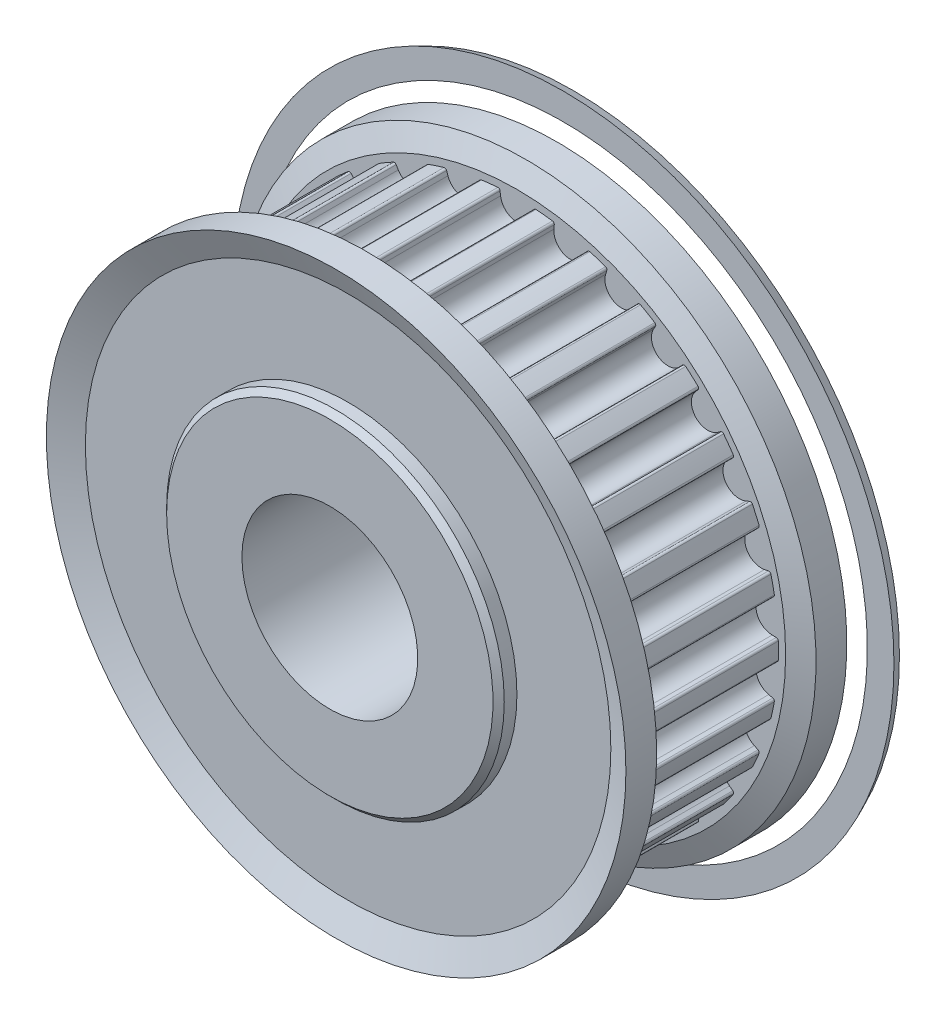
from build123d import *

# Parameters (mm, degrees)
CUT_EXTRUDE_START        = 2.5
CUT_EXTRUDE_1_DEPTH      = 5
PATTERN_CIRCULAR_1_COUNT = 30
CUT_EXTRUDE_START_2      = -4.15
SKETCH_5_R               = 2.5
CUT_EXTRUDE_H_DEPTH      = 8.3
CHAMFER_1_SIZE           = 0.2
SCALE_1_SCALE            = 4
SKETCH_10_R              = 12.5
CUT_EXTRUDE_2_DEPTH      = 52
SKETCH_11_OUTSIDE_W      = 126.092
SKETCH_11_OUTSIDE_H      = 126.092
SKETCH_11_OUTSIDE_R      = 41.195256212
CUT_EXTRUDE_3_DEPTH      = 52


with BuildPart() as part:
    # 草图3 → 旋转1 (revolve)
    with BuildSketch(Plane(origin=(0, 0, 0), x_dir=(0, 0, -1), z_dir=(1, 0, 0)), mode=Mode.PRIVATE) as revolve_1_sk:
        Polygon((-4.15, 6), (-4.15, 0), (4.15, 0), (4.15, 6), (3.5, 6), (3.5, 9.338343886), (4.5, 11.594838331), (3.585754944, 12), (2.5, 9.55), (2.5, 9.295), (-2.5, 9.295), (-2.5, 9.55), (-3.585754944, 12), (-4.5, 11.594838331), (-3.5, 9.338343886), (-3.5, 6), align=None)
    revolve(revolve_1_sk.sketch.rotate(Axis((0, 0, 34.781081475), (0, 0, -1)), 90), axis=Axis((0, 0, 34.781081475), (0, 0, -1)))

    # 草图4 → Cut-Extrude 1 (cut)
    with BuildSketch(Plane.XY.offset(CUT_EXTRUDE_START)):
        with BuildLine():
            Line((-0.582284978, 9.060162231), (-0.6, 9.20443951))
            ThreePointArc((-0.6, 9.20443951), (-0.626833604, 9.253252217), (-0.679927195, 9.270098382))
            ThreePointArc((-0.679927195, 9.270098382), (0, 9.295), (0.679927195, 9.270098382))
            ThreePointArc((0.679927195, 9.270098382), (0.626833604, 9.253252217), (0.6, 9.20443951))
            Line((0.6, 9.20443951), (0.582284978, 9.060162231))
            ThreePointArc((0.582284978, 9.060162231), (0, 8.545), (-0.582284978, 9.060162231))
        make_face()
    cut_extrude_1 = extrude(amount=-CUT_EXTRUDE_1_DEPTH, mode=Mode.SUBTRACT)

    # 阵列(圆周)1: Cut-Extrude 1 ×30 about axis
    pattern_circular_1_axis = Axis((0, 0, 0), (0, 0, 1))
    for i in range(1, PATTERN_CIRCULAR_1_COUNT):
        add(cut_extrude_1.rotate(pattern_circular_1_axis, i * 360 / PATTERN_CIRCULAR_1_COUNT), mode=Mode.SUBTRACT)

    # 草图5 → H (cut)
    with BuildSketch(Plane.XY.offset(CUT_EXTRUDE_START_2)):
        with Locations(Location((0, 0, 0), (0, 0, 180))):
            Circle(SKETCH_5_R)
    extrude(amount=CUT_EXTRUDE_H_DEPTH, mode=Mode.SUBTRACT)

    # 倒角1
    chamfer_1_edges = [part.edges().sort_by_distance(p)[0] for p in [
        (-6, 0, -4.15),
        (-6, 0, 4.15),
    ]]
    chamfer(chamfer_1_edges, length=CHAMFER_1_SIZE)


with BuildPart() as part_1:
    # 缩放比例1: scaled about (0, 0, 0)
    add(part.part.scale(SCALE_1_SCALE))

    # 草图10 → 切除-拉伸2 (cut)
    with BuildSketch(Plane(origin=(0, 0, -16.6), x_dir=(-1, 0, 0), z_dir=(0, 0, -1))):
        Circle(SKETCH_10_R)
    extrude(amount=-CUT_EXTRUDE_2_DEPTH, mode=Mode.SUBTRACT)

    # 草图11 outside → 切除-拉伸3 (cut)
    with BuildSketch(Plane(origin=(0, 0, -16.6), x_dir=(-1, 0, 0), z_dir=(0, 0, -1))):
        Rectangle(SKETCH_11_OUTSIDE_W, SKETCH_11_OUTSIDE_H)
        with Locations(Location((0, 0, 0), (0, 0, 180))):
            Circle(SKETCH_11_OUTSIDE_R, mode=Mode.SUBTRACT)
    extrude(amount=-CUT_EXTRUDE_3_DEPTH, mode=Mode.SUBTRACT)


with BuildPart() as cut_extrude_3_piece_1:
    # of the separate pieces the step leaves, piece 1, a body of its own (cut_extrude_3_pieces)
    add(part_1.part.solids().sort_by_distance((23.2, 0, 16.6))[0])


with BuildPart() as cut_extrude_3_piece_2:
    # of the separate pieces the step leaves, piece 2, a body of its own (cut_extrude_3_pieces)
    add(part_1.part.solids().sort_by_distance((43.220261101, 0, -16.6))[0])


solid = Compound([cut_extrude_3_piece_1.part, cut_extrude_3_piece_2.part])
